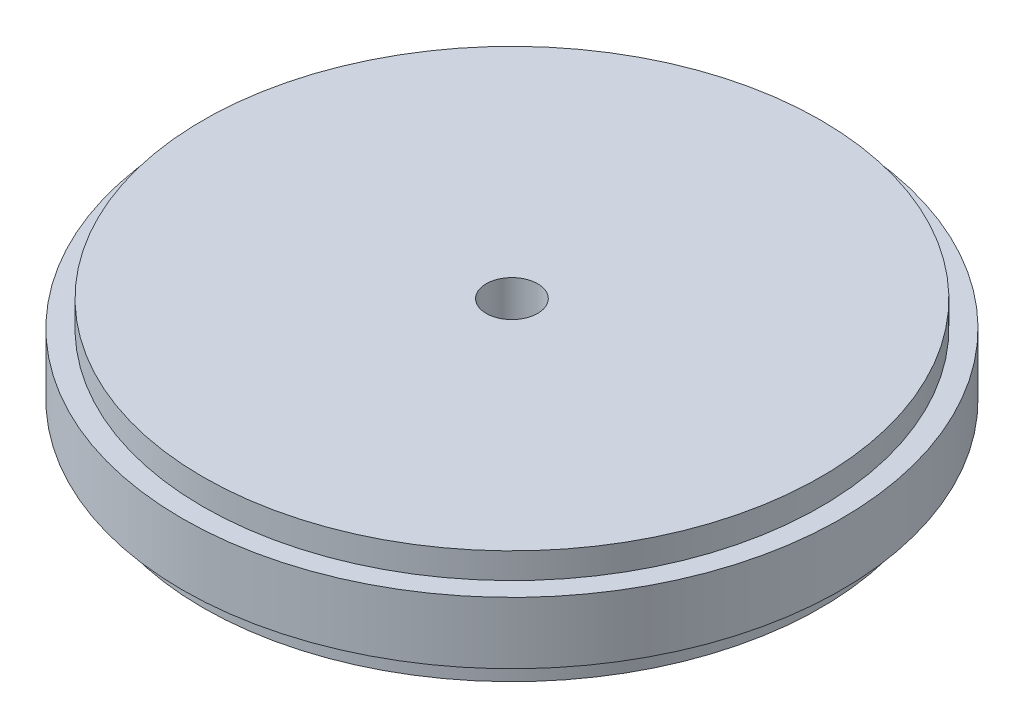
from build123d import *

# Parameters (mm, degrees)
SKETCH_1_R      = 32
SKETCH_1_R_2    = 30
EXTRUDE_1_DEPTH = 3
SKETCH_1_3_R    = 30
SKETCH_1_3_R_2  = 9
EXTRUDE_2_DEPTH = 5.5
SKETCH_1_5_R    = 9
SKETCH_1_5_R_2  = 2.5
EXTRUDE_3_DEPTH = 5.5
EXTRUDE_START   = -14
SKETCH_1_6_R    = 9
SKETCH_1_6_R_2  = 2.5
EXTRUDE_4_DEPTH = 14


with BuildPart() as part:
    # 草图1 → 凸台-拉伸1 (new, symmetric)
    with BuildSketch(Plane(origin=(0, 0, 0), x_dir=(1, 0, 0), z_dir=(0, 1, 0))):
        Circle(SKETCH_1_R)
        Circle(SKETCH_1_R_2, mode=Mode.SUBTRACT)
    extrude(amount=EXTRUDE_1_DEPTH, both=True)

    # 草图1<3> → 凸台-拉伸2 (add, symmetric)
    with BuildSketch(Plane(origin=(0, 0, 0), x_dir=(1, 0, 0), z_dir=(0, 1, 0))):
        Circle(SKETCH_1_3_R)
        Circle(SKETCH_1_3_R_2, mode=Mode.SUBTRACT)
    extrude(amount=EXTRUDE_2_DEPTH, both=True)

    # 草图1<5> → 凸台-拉伸3 (add)
    with BuildSketch(Plane(origin=(0, 0, 0), x_dir=(1, 0, 0), z_dir=(0, 1, 0))):
        Circle(SKETCH_1_5_R)
        Circle(SKETCH_1_5_R_2, mode=Mode.SUBTRACT)
    extrude(amount=EXTRUDE_3_DEPTH)

    # 草图1<6> → 凸台-拉伸4 (add)
    with BuildSketch(Plane(origin=(0, 0, 0), x_dir=(1, 0, 0), z_dir=(0, 1, 0)).offset(EXTRUDE_START)):
        Circle(SKETCH_1_6_R)
        Circle(SKETCH_1_6_R_2, mode=Mode.SUBTRACT)
    extrude(amount=EXTRUDE_4_DEPTH)


solid = part.part
